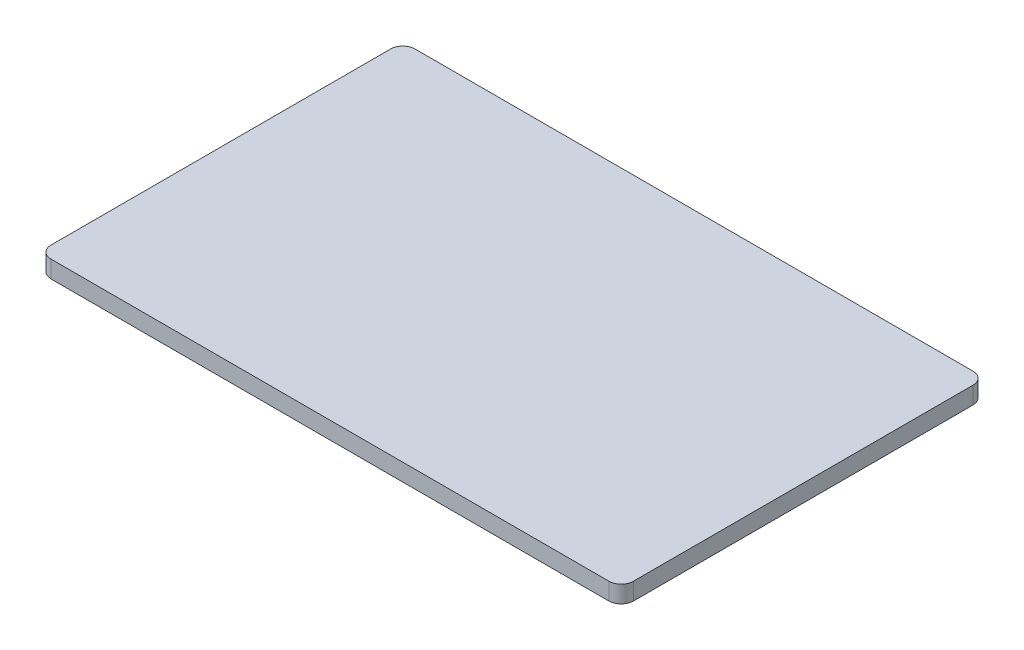
from build123d import *

# Parameters (mm, degrees)
SKETCH1_W           = 304.8
SKETCH1_H           = 190.5
BOSS_EXTRUDE1_DEPTH = 13.589
CHAMFER1_SIZE       = 13.97
CHAMFER1_SIZE2      = 4.572
CHAMFER2_SIZE       = 13.97
CHAMFER2_SIZE2      = 4.572
CHAMFER3_SIZE       = 13.97
CHAMFER3_SIZE2      = 4.572
CHAMFER4_SIZE       = 13.97
CHAMFER4_SIZE2      = 4.572
FILLET1_R           = 6.35
FILLET3_R           = 25.4


with BuildPart() as part:
    # Sketch1 → Boss-Extrude1 (new body)
    with BuildSketch(Plane(origin=(0, 0, 0), x_dir=(1, 0, 0), z_dir=(0, 1, 0))):
        Rectangle(SKETCH1_W, SKETCH1_H)
    extrude(amount=BOSS_EXTRUDE1_DEPTH)

    # Chamfer1
    chamfer1_edges = [part.edges().sort_by_distance(p)[0] for p in [
        (-152.4, 0, 0),
    ]]
    chamfer1_side = [part.faces().sort_by_distance(p)[0] for p in [
        (0, 0, 0),
    ]]
    chamfer(chamfer1_edges, length=CHAMFER1_SIZE, length2=CHAMFER1_SIZE2, reference=chamfer1_side[0])

    # Chamfer2
    chamfer2_edges = [part.edges().sort_by_distance(p)[0] for p in [
        (6.985, 0, -95.25),
    ]]
    chamfer2_side = [part.faces().sort_by_distance(p)[0] for p in [
        (6.985, 0, 0),
    ]]
    chamfer(chamfer2_edges, length=CHAMFER2_SIZE, length2=CHAMFER2_SIZE2, reference=chamfer2_side[0])

    # Chamfer3
    chamfer3_edges = [part.edges().sort_by_distance(p)[0] for p in [
        (152.4, 0, 6.985),
    ]]
    chamfer3_side = [part.faces().sort_by_distance(p)[0] for p in [
        (6.985, 0, 6.985),
    ]]
    chamfer(chamfer3_edges, length=CHAMFER3_SIZE, length2=CHAMFER3_SIZE2, reference=chamfer3_side[0])

    # Chamfer4
    chamfer4_edges = [part.edges().sort_by_distance(p)[0] for p in [
        (0, 0, 95.25),
    ]]
    chamfer4_side = [part.faces().sort_by_distance(p)[0] for p in [
        (0, 0, 6.985),
    ]]
    chamfer(chamfer4_edges, length=CHAMFER4_SIZE, length2=CHAMFER4_SIZE2, reference=chamfer4_side[0])

    # Fillet1
    fillet1_edges = [part.edges().sort_by_distance(p)[0] for p in [
        (152.4, 9.0805, 95.25),
        (-152.4, 9.0805, 95.25),
        (-152.4, 9.0805, -95.25),
        (152.4, 9.0805, -95.25),
    ]]
    fillet(fillet1_edges, radius=FILLET1_R)

    # Fillet3
    fillet3_edges = [part.edges().sort_by_distance(p)[0] for p in [
        (0, 0, 81.28),
        (144.48506403, 1.981657319, 87.33506403),
        (138.43, 0, 0),
        (144.48506403, 1.981657319, -87.33506403),
        (0, 0, -81.28),
        (-144.48506403, 1.981657319, -87.33506403),
        (-138.43, 0, 0),
        (-144.48506403, 1.981657319, 87.33506403),
    ]]
    fillet(fillet3_edges, radius=FILLET3_R)


solid = part.part
